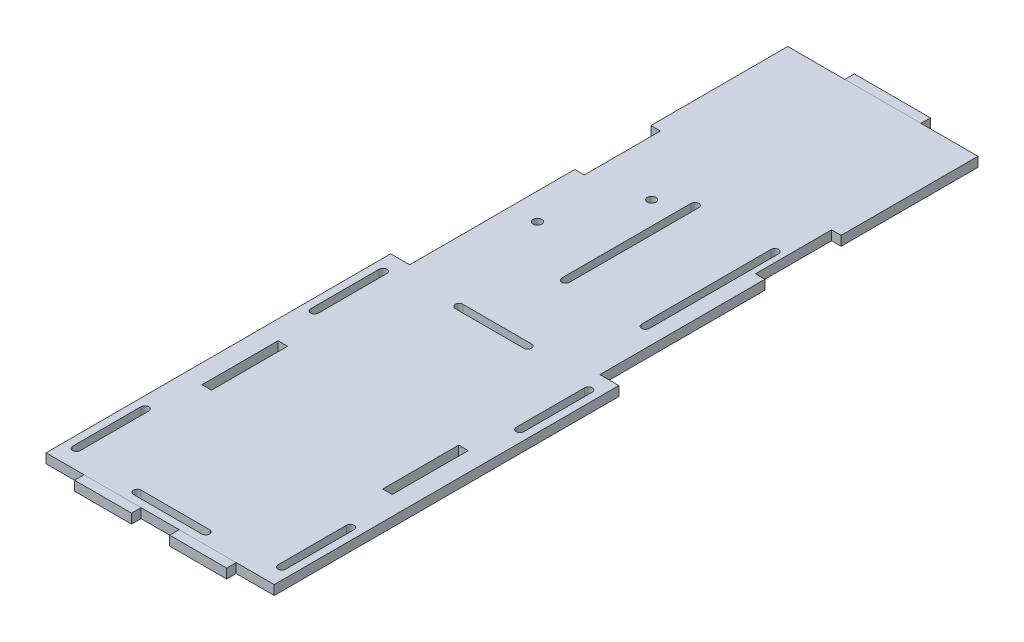
from build123d import *

# Parameters (mm, degrees)
SKETCH1_W             = 76.2
SKETCH1_H             = 241.3
BOSS_EXTRUDE1_DEPTH   = 3.175
SKETCH5_W             = 6.35
SKETCH5_H             = 126.238
CUT_EXTRUDE11_DEPTH   = 3.175
SKETCH5_4_W           = 6.35
SKETCH5_4_H           = 126.238
CUT_EXTRUDE12_DEPTH   = 3.175
SKETCH7_W             = 3.175
SKETCH7_H             = 25.4
CUT_EXTRUDE13_DEPTH   = 3.175
SKETCH7_3_W           = 3.175
SKETCH7_3_H           = 25.4
CUT_EXTRUDE14_DEPTH   = 3.175
SKETCH8_W             = 19.05
SKETCH8_H             = 3.175
BOSS_EXTRUDE2_DEPTH   = 3.175
BOSS_EXTRUDE2_2_DEPTH = 3.175
SKETCH8_W_2           = 25.4
BOSS_EXTRUDE2_3_DEPTH = 3.175
CUT_EXTRUDE15_DEPTH   = 3.175
SKETCH10_R            = 1.4224
CUT_EXTRUDE16_DEPTH   = 3.175


with BuildPart() as part:
    # Sketch1 → Boss-Extrude1 (new body)
    with BuildSketch(Plane(origin=(0, 0, 0), x_dir=(1, 0, 0), z_dir=(0, 1, 0))):
        Rectangle(SKETCH1_W, SKETCH1_H)
    extrude(amount=BOSS_EXTRUDE1_DEPTH)

    # Sketch5 → Cut-Extrude11 (cut)
    with BuildSketch(Plane(origin=(0, 3.175, 0), x_dir=(1, 0, 0), z_dir=(0, 1, 0))):
        with Locations((-34.925, 57.531)):
            Rectangle(SKETCH5_W, SKETCH5_H)
    extrude(amount=-CUT_EXTRUDE11_DEPTH, mode=Mode.SUBTRACT)

    # Sketch5<4> → Cut-Extrude12 (cut)
    with BuildSketch(Plane(origin=(0, 3.175, 0), x_dir=(1, 0, 0), z_dir=(0, 1, 0))):
        with Locations((34.925, 57.531)):
            Rectangle(SKETCH5_4_W, SKETCH5_4_H)
    extrude(amount=-CUT_EXTRUDE12_DEPTH, mode=Mode.SUBTRACT)

    # Sketch7 → Cut-Extrude13 (cut)
    with BuildSketch(Plane(origin=(0, 3.175, 0), x_dir=(1, 0, 0), z_dir=(0, 1, 0))):
        with Locations((-30.1625, -62.23)):
            Rectangle(SKETCH7_W, SKETCH7_H)
    extrude(amount=-CUT_EXTRUDE13_DEPTH, mode=Mode.SUBTRACT)

    # Sketch7<3> → Cut-Extrude14 (cut)
    with BuildSketch(Plane(origin=(0, 3.175, 0), x_dir=(1, 0, 0), z_dir=(0, 1, 0))):
        with Locations((-30.1625, -62.23)):
            Rectangle(SKETCH7_3_W, SKETCH7_3_H)
        with Locations((30.1625, -62.23)):
            Rectangle(SKETCH7_3_W, SKETCH7_3_H)
        with Locations((-30.1625, 62.23)):
            Rectangle(SKETCH7_3_W, SKETCH7_3_H)
        with Locations((30.1625, 62.23)):
            Rectangle(SKETCH7_3_W, SKETCH7_3_H)
    extrude(amount=-CUT_EXTRUDE14_DEPTH, mode=Mode.SUBTRACT)

    # Sketch9 → Cut-Extrude15 (cut)
    with BuildSketch(Plane(origin=(0, 3.175, 0), x_dir=(1, 0, 0), z_dir=(0, 1, 0))):
        with BuildLine():
            Line((-11.43, -115.57), (11.43, -115.57))
            ThreePointArc((11.43, -115.57), (12.7, -116.84), (11.43, -118.11))
            Line((11.43, -118.11), (-11.43, -118.11))
            ThreePointArc((-11.43, -118.11), (-12.7, -116.84), (-11.43, -115.57))
        make_face()
        with BuildLine():
            Line((-11.43, -8.128), (11.43, -8.128))
            ThreePointArc((11.43, -8.128), (12.7, -9.398), (11.43, -10.668))
            Line((11.43, -10.668), (-11.43, -10.668))
            ThreePointArc((-11.43, -10.668), (-12.7, -9.398), (-11.43, -8.128))
        make_face()
        with BuildLine():
            Line((-35.56, -114.3), (-35.56, -91.44))
            ThreePointArc((-35.56, -91.44), (-34.29, -90.17), (-33.02, -91.44))
            Line((-33.02, -91.44), (-33.02, -114.3))
            ThreePointArc((-33.02, -114.3), (-34.29, -115.57), (-35.56, -114.3))
        make_face()
        with BuildLine():
            Line((33.02, -114.3), (33.02, -91.44))
            ThreePointArc((33.02, -91.44), (34.29, -90.17), (35.56, -91.44))
            Line((35.56, -91.44), (35.56, -114.3))
            ThreePointArc((35.56, -114.3), (34.29, -115.57), (33.02, -114.3))
        make_face()
        with BuildLine():
            Line((33.02, -34.798), (33.02, -11.938))
            ThreePointArc((33.02, -11.938), (34.29, -10.668), (35.56, -11.938))
            Line((35.56, -11.938), (35.56, -34.798))
            ThreePointArc((35.56, -34.798), (34.29, -36.068), (33.02, -34.798))
        make_face()
        with BuildLine():
            Line((-35.56, -34.798), (-35.56, -11.938))
            ThreePointArc((-35.56, -11.938), (-34.29, -10.668), (-33.02, -11.938))
            Line((-33.02, -11.938), (-33.02, -34.798))
            ThreePointArc((-33.02, -34.798), (-34.29, -36.068), (-35.56, -34.798))
        make_face()
    extrude(amount=-CUT_EXTRUDE15_DEPTH, mode=Mode.SUBTRACT)

    # Sketch10 → Cut-Extrude16 (cut)
    with BuildSketch(Plane(origin=(0, 3.175, 0), x_dir=(1, 0, 0), z_dir=(0, 1, 0))):
        with Locations((-22.86, 28.194)):
            Circle(SKETCH10_R)
        with Locations((-10.16, 53.594)):
            Circle(SKETCH10_R)
        with BuildLine():
            Line((-2.54, 16.002), (-2.54, 59.182))
            ThreePointArc((-2.54, 59.182), (-1.27, 60.452), (0, 59.182))
            Line((0, 59.182), (0, 16.002))
            ThreePointArc((0, 16.002), (-1.27, 14.732), (-2.54, 16.002))
        make_face()
        with BuildLine():
            Line((24.13, 16.002), (24.13, 59.182))
            ThreePointArc((24.13, 59.182), (25.4, 60.452), (26.67, 59.182))
            Line((26.67, 59.182), (26.67, 16.002))
            ThreePointArc((26.67, 16.002), (25.4, 14.732), (24.13, 16.002))
        make_face()
    extrude(amount=-CUT_EXTRUDE16_DEPTH, mode=Mode.SUBTRACT)


with BuildPart() as body_2:
    # Sketch8 → Boss-Extrude2 (new body)
    with BuildSketch(Plane(origin=(0, 3.175, 0), x_dir=(1, 0, 0), z_dir=(0, 1, 0))):
        with Locations((-15.875, -122.2375)):
            Rectangle(SKETCH8_W, SKETCH8_H)
    extrude(amount=-BOSS_EXTRUDE2_DEPTH)


with BuildPart() as body_3:
    # Sketch8 → Boss-Extrude2 2 (new body)
    with BuildSketch(Plane(origin=(0, 3.175, 0), x_dir=(1, 0, 0), z_dir=(0, 1, 0))):
        with Locations((15.875, -122.2375)):
            Rectangle(SKETCH8_W, SKETCH8_H)
    extrude(amount=-BOSS_EXTRUDE2_2_DEPTH)


with BuildPart() as body_4:
    # Sketch8 → Boss-Extrude2 3 (new body)
    with BuildSketch(Plane(origin=(0, 3.175, 0), x_dir=(1, 0, 0), z_dir=(0, 1, 0))):
        with Locations((0, 122.2375)):
            Rectangle(SKETCH8_W_2, SKETCH8_H)
    extrude(amount=-BOSS_EXTRUDE2_3_DEPTH)


solid = Compound([part.part, body_2.part, body_3.part, body_4.part])
